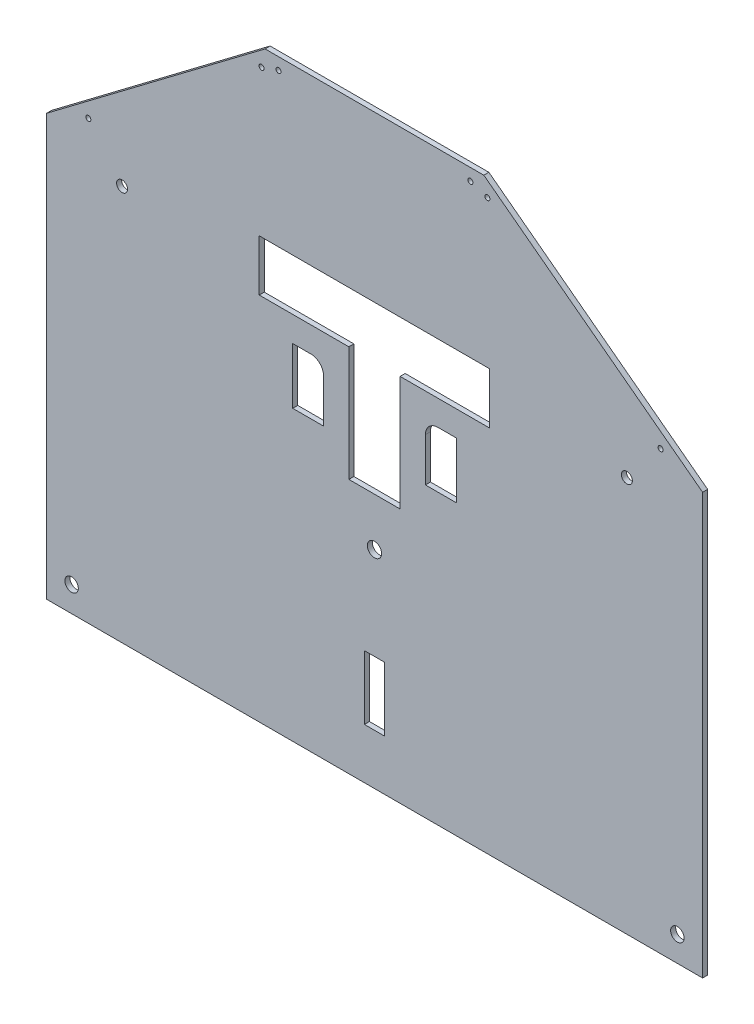
from build123d import *
from build123d.topology import SkipClean

# Parameters (mm, degrees)
BOSS_EXTRUDE1_DEPTH     = 3
CROQUIS1_W              = 50.575264902
CROQUIS1_H              = 364.883290788
CROQUIS1_W_2            = 121.011581191
CROQUIS1_H_2            = 356.31671178
CORTAR_EXTRUIR1_DEPTH   = 10
CROQUIS2_W              = 390
CROQUIS2_H              = 250
SALIENTE_EXTRUIR1_DEPTH = 3
CROQUIS3_W              = 60
CROQUIS3_H              = 30
CORTAR_EXTRUIR3_DEPTH   = 3
CROQUIS4_W              = 90
CROQUIS4_H              = 3
SALIENTE_EXTRUIR2_DEPTH = 3
CROQUIS5_W              = 30
CROQUIS5_H              = 30
CORTAR_EXTRUIR4_DEPTH   = 3
CROQUIS6_W              = 30
CROQUIS6_H              = 38.5
CORTAR_EXTRUIR5_DEPTH   = 3
CROQUIS7_W              = 38.5
CROQUIS7_H              = 30
CORTAR_EXTRUIR6_DEPTH   = 3
CROQUIS8_W              = 137
CROQUIS8_H              = 0.25
CORTAR_EXTRUIR7_DEPTH   = 3
CROQUIS9_W              = 0.25
CROQUIS9_H              = 68.25
CORTAR_EXTRUIR8_DEPTH   = 3
CORTAR_EXTRUIR9_DEPTH   = 3
SALIENTE_EXTRUIR3_DEPTH = 3
CROQUIS12_R             = 4
CORTAR_EXTRUIR10_DEPTH  = 3
CROQUIS13_R             = 4.25
CROQUIS13_R_2           = 3.25
SALIENTE_EXTRUIR4_DEPTH = 3
CROQUIS14_R             = 4.25
CORTAR_EXTRUIR11_DEPTH  = 3
CROQUIS15_R             = 4.25
CORTAR_EXTRUIR12_DEPTH  = 25
SALIENTE_EXTRUIR5_DEPTH = 3
CROQUIS17_R             = 1.5
CORTAR_EXTRUIR13_DEPTH  = 10
CROQUIS18_R             = 1.5
CORTAR_EXTRUIR14_DEPTH  = 30
CROQUIS19_R             = 1.5
SALIENTE_EXTRUIR6_DEPTH = 3
CROQUIS21_R             = 1.5
CORTAR_EXTRUIR15_DEPTH  = 3
SALIENTE_EXTRUIR7_DEPTH = 3
CORTAR_EXTRUIR17_DEPTH  = 10
CORTAR_EXTRUIR18_DEPTH  = 10


with BuildPart() as part:
    # Sketch1 → Boss-Extrude1 (new body)
    with BuildSketch(Plane.XY):
        Polygon((0, 0), (403.39, 0), (403.39, 241), (274.41, 359.5), (128.98, 359.5), (0, 241), align=None)
        Polygon((216.695, 223), (246.695, 223), (246.695, 253), (156.695, 253), (156.695, 223), (186.695, 223), (186.695, 219.825), (216.695, 219.825), align=None, mode=Mode.SUBTRACT)
    extrude(amount=BOSS_EXTRUDE1_DEPTH)

    # Croquis1 → Cortar-Extruir1 (cut)
    with BuildSketch(Plane.XY.offset(3)):
        with Locations((-18.592632451, 182.441645394)):
            Rectangle(CROQUIS1_W, CROQUIS1_H)
        with Locations((457.200790596, 178.15835589)):
            Rectangle(CROQUIS1_W_2, CROQUIS1_H_2)
    extrude(amount=-CORTAR_EXTRUIR1_DEPTH, mode=Mode.SUBTRACT)

    # Croquis2 → Saliente-Extruir1 (add)
    with BuildSketch(Plane.XY.offset(3)):
        with Locations((201.695, 125)):
            Rectangle(CROQUIS2_W, CROQUIS2_H)
    extrude(amount=-SALIENTE_EXTRUIR1_DEPTH)

    # Croquis3 → Cortar-Extruir3 (cut)
    with BuildSketch(Plane.XY.offset(3)):
        with Locations((201.695, 235)):
            Rectangle(CROQUIS3_W, CROQUIS3_H)
    extrude(amount=-CORTAR_EXTRUIR3_DEPTH, mode=Mode.SUBTRACT)

    # Croquis4 → Saliente-Extruir2 (add)
    with BuildSketch(Plane.XY.offset(3)):
        with Locations((201.695, 251.5)):
            Rectangle(CROQUIS4_W, CROQUIS4_H)
    extrude(amount=-SALIENTE_EXTRUIR2_DEPTH)

    # Croquis5 → Cortar-Extruir4 (cut)
    with BuildSketch(Plane.XY.offset(3)):
        with Locations((201.695, 205)):
            Rectangle(CROQUIS5_W, CROQUIS5_H)
    extrude(amount=-CORTAR_EXTRUIR4_DEPTH, mode=Mode.SUBTRACT)

    # Croquis6 → Cortar-Extruir5 (cut)
    with BuildSketch(Plane.XY.offset(3)):
        with Locations((201.695, 170.75)):
            Rectangle(CROQUIS6_W, CROQUIS6_H)
    extrude(amount=-CORTAR_EXTRUIR5_DEPTH, mode=Mode.SUBTRACT)

    # Croquis7 → Cortar-Extruir6 (cut)
    with BuildSketch(Plane.XY.offset(3)):
        with Locations((152.445, 235)):
            Rectangle(CROQUIS7_W, CROQUIS7_H)
        with Locations((250.945, 235)):
            Rectangle(CROQUIS7_W, CROQUIS7_H)
    extrude(amount=-CORTAR_EXTRUIR6_DEPTH, mode=Mode.SUBTRACT)

    # Croquis8 → Cortar-Extruir7 (cut)
    with BuildSketch(Plane.XY.offset(3)):
        with Locations((201.695, 250.125)):
            Rectangle(CROQUIS8_W, CROQUIS8_H)
        with Locations((201.695, 219.875)):
            Rectangle(CROQUIS8_W, CROQUIS8_H)
    extrude(amount=-CORTAR_EXTRUIR7_DEPTH, mode=Mode.SUBTRACT)

    # Croquis9 → Cortar-Extruir8 (cut)
    with BuildSketch(Plane.XY.offset(3)):
        with Locations((186.57, 185.625)):
            Rectangle(CROQUIS9_W, CROQUIS9_H)
        with Locations((216.82, 185.625)):
            Rectangle(CROQUIS9_W, CROQUIS9_H)
    extrude(amount=-CORTAR_EXTRUIR8_DEPTH, mode=Mode.SUBTRACT)

    # Croquis10 → Cortar-Extruir9 (cut)
    with BuildSketch(Plane.XY.offset(3)):
        Polygon((136.695, 348.165217873), (266.695, 348.165217873), (396.695, 250), (402.242964747, 389.308105161), (24.251899655, 412.117910813), (6.695, 250), align=None)
    extrude(amount=-CORTAR_EXTRUIR9_DEPTH, mode=Mode.SUBTRACT)

    # Croquis11 → Saliente-Extruir3 (add)
    with BuildSketch(Plane.XY.offset(3)):
        Polygon((51.733112384, 284.009047037), (6.695, 250), (31.650370126, 216.951653685), align=None)
        Polygon((347.889102287, 286.854166019), (396.695, 250), (356.623353442, 225.729213199), align=None)
    extrude(amount=-SALIENTE_EXTRUIR3_DEPTH)

    # Croquis12 → Cortar-Extruir10 (cut)
    with BuildSketch(Plane.XY.offset(3)):
        with Locations((21.695, 15)):
            Circle(CROQUIS12_R)
        with Locations((381.695, 15)):
            Circle(CROQUIS12_R)
        with Locations((51.695, 235)):
            Circle(CROQUIS12_R)
        with Locations((351.695, 235)):
            Circle(CROQUIS12_R)
    extrude(amount=-CORTAR_EXTRUIR10_DEPTH, mode=Mode.SUBTRACT)

    # Croquis13 → Saliente-Extruir4 (add)
    # profile 1 of 2: a face of its own
    with BuildSketch(Plane.XY.offset(3)):
        with Locations((51.695, 235)):
            Circle(CROQUIS13_R)
        with Locations((51.695, 235)):
            Circle(CROQUIS13_R_2, mode=Mode.SUBTRACT)
    # profile 2 of 2: a face of its own
    with BuildSketch(Plane.XY.offset(3)):
        with Locations((351.695, 235)):
            Circle(CROQUIS13_R)
        with Locations((351.695, 235)):
            Circle(CROQUIS13_R_2, mode=Mode.SUBTRACT)
    extrude(amount=-SALIENTE_EXTRUIR4_DEPTH)

    # Croquis14 → Cortar-Extruir11 (cut)
    with BuildSketch(Plane.XY.offset(3)):
        with Locations((201.695, 35)):
            Circle(CROQUIS14_R)
        with Locations((201.695, 123)):
            Circle(CROQUIS14_R)
    extrude(amount=-CORTAR_EXTRUIR11_DEPTH, mode=Mode.SUBTRACT)

    # Croquis15 → Cortar-Extruir12 (cut)
    with BuildSketch(Plane.XY.offset(3)):
        with Locations((201.695, 38)):
            Circle(CROQUIS15_R)
    extrude(amount=-CORTAR_EXTRUIR12_DEPTH, mode=Mode.SUBTRACT)

    # Croquis16 → Saliente-Extruir5 (add)
    with BuildSketch(Plane.XY.offset(3)):
        with BuildLine():
            ThreePointArc((205.67149343, 36.5), (201.695, 33.75), (197.71850657, 36.5))
            ThreePointArc((197.71850657, 36.5), (200.9326343, 30.818935717), (205.945, 35))
            ThreePointArc((205.945, 35), (205.876064283, 35.7623657), (205.67149343, 36.5))
        make_face()
    extrude(amount=-SALIENTE_EXTRUIR5_DEPTH)

    # Croquis17 → Cortar-Extruir13 (cut)
    with BuildSketch(Plane.XY.offset(3)):
        with Locations((146.568722662, 341.065217873)):
            Circle(CROQUIS17_R)
        with Locations((254.977292633, 341.065217873)):
            Circle(CROQUIS17_R)
        with Locations((134.589248293, 337.678282679)):
            Circle(CROQUIS17_R)
        with Locations((31.642655291, 259.941553977)):
            Circle(CROQUIS17_R)
        with Locations((268.800751707, 337.678282679)):
            Circle(CROQUIS17_R)
        with Locations((371.747344709, 259.941553977)):
            Circle(CROQUIS17_R)
    extrude(amount=-CORTAR_EXTRUIR13_DEPTH, mode=Mode.SUBTRACT)

    # Croquis18 → Cortar-Extruir14 (cut)
    with BuildSketch(Plane.XY.offset(3)):
        with Locations((144.695, 341.065217873)):
            Circle(CROQUIS18_R)
        with Locations((258.695, 341.065217873)):
            Circle(CROQUIS18_R)
    extrude(amount=-CORTAR_EXTRUIR14_DEPTH, mode=Mode.SUBTRACT)

    # Croquis19 → Saliente-Extruir6 (add)
    with BuildSketch(Plane.XY.offset(3)):
        with BuildLine():
            ThreePointArc((145.631861331, 339.893769689), (145.068722662, 341.065217873), (145.631861331, 342.236666056))
            ThreePointArc((145.631861331, 342.236666056), (143.195, 341.065217873), (145.631861331, 339.893769689))
        make_face()
        with Locations((254.977292633, 341.065217873)):
            Circle(CROQUIS19_R)
    extrude(amount=-SALIENTE_EXTRUIR6_DEPTH)

    # Croquis21 → Cortar-Extruir15 (cut)
    with BuildSketch(Plane.XY.offset(3)):
        with Locations((144.695, 341.065217873)):
            Circle(CROQUIS21_R)
    extrude(amount=-CORTAR_EXTRUIR15_DEPTH, mode=Mode.SUBTRACT)

    # Croquis22 → Saliente-Extruir7 (add)
    with BuildSketch(Plane.XY.offset(3)):
        with BuildLine():
            ThreePointArc((145.631861331, 342.236666056), (146.046904582, 341.715105557), (146.195, 341.065217873))
            ThreePointArc((146.195, 341.065217873), (146.046904582, 340.415330189), (145.631861331, 339.893769689))
            ThreePointArc((145.631861331, 339.893769689), (147.218610346, 339.713313291), (148.068722662, 341.065217873))
            ThreePointArc((148.068722662, 341.065217873), (147.218610346, 342.417122454), (145.631861331, 342.236666056))
        make_face()
    extrude(amount=-SALIENTE_EXTRUIR7_DEPTH)

    # Croquis23 → Cortar-Extruir17 (cut)
    with BuildSketch(Plane.XY.offset(3)):
        with BuildLine():
            ThreePointArc((163.945, 204.75), (169.248300859, 202.553300859), (171.445, 197.25))
            Line((171.445, 197.25), (171.445, 171.4))
            Line((171.445, 171.4), (153.095, 171.4))
            Line((153.095, 171.4), (153.095, 204.75))
            Line((153.095, 204.75), (163.945, 204.75))
        make_face()
        with BuildLine():
            Line((250.295, 204.75), (239.445, 204.75))
            ThreePointArc((239.445, 204.75), (234.141699141, 202.553300859), (231.945, 197.25))
            Line((231.945, 197.25), (231.945, 171.4))
            Line((231.945, 171.4), (250.295, 171.4))
            Line((250.295, 171.4), (250.295, 204.75))
        make_face()
    extrude(amount=-CORTAR_EXTRUIR17_DEPTH, mode=Mode.SUBTRACT)

    # Croquis25 → Cortar-Extruir18 (cut)
    with SkipClean():  # the faces are left unmerged after this step: merging them gives an invalid solid
        with BuildSketch(Plane.XY.offset(3)):
            Polygon((195.695, 38), (195.695, 30), (207.695, 30), (207.695, 38), (207.695, 68), (195.695, 68), align=None)
        extrude(amount=-CORTAR_EXTRUIR18_DEPTH, mode=Mode.SUBTRACT)


solid = part.part
